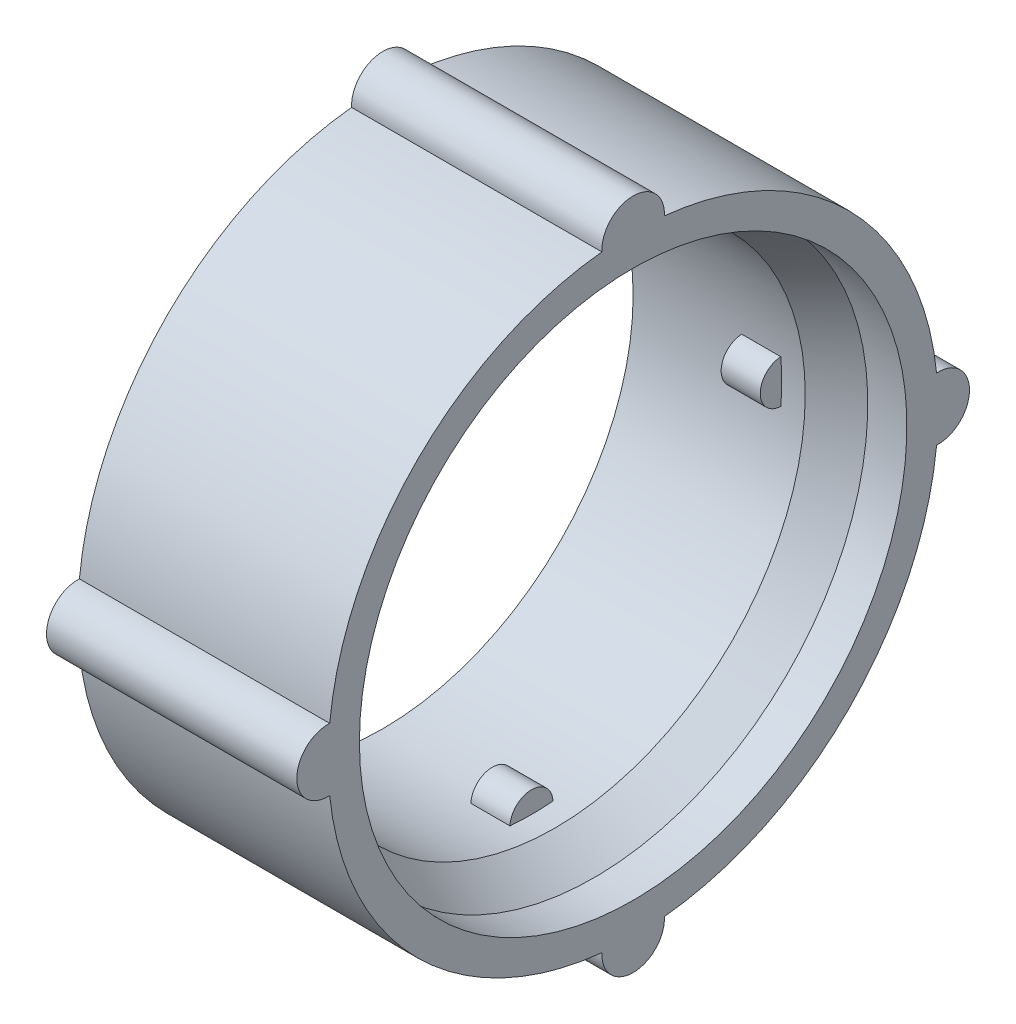
from build123d import *

# Parameters (mm, degrees)
SKETCH1_W           = 16
SKETCH1_H           = 3.5
BOSS_EXTRUDE1_START = -7
SKETCH3_R           = 1.375
BOSS_EXTRUDE1_DEPTH = 2.5
SKETCH4_R           = 2
BOSS_EXTRUDE2_DEPTH = 16


with BuildPart() as part:
    # Sketch1 → Revolve1 (revolve)
    with BuildSketch(Plane(origin=(0, 0, 0), x_dir=(1, 0, 0), z_dir=(0, 1, 0)), mode=Mode.PRIVATE) as revolve1_sk:
        with Locations((8, 17.75)):
            Rectangle(SKETCH1_W, SKETCH1_H)
    revolve(revolve1_sk.sketch.rotate(Axis((0, 0, 0), (1, 0, 0)), 180), axis=Axis((0, 0, 0), (1, 0, 0)))

    # Sketch2 → Cut-Revolve1 (revolve, cut)
    with BuildSketch(Plane(origin=(0, 0, 0), x_dir=(1, 0, 0), z_dir=(0, 1, 0)), mode=Mode.PRIVATE) as cut_revolve1_sk:
        Polygon((16, 17.5), (13.5, 17.5), (11, 16), (16, 16), align=None)
    revolve(cut_revolve1_sk.sketch.rotate(Axis((0, 0, 0), (1, 0, 0)), 180), axis=Axis((0, 0, 0), (1, 0, 0)), mode=Mode.SUBTRACT)

    # Sketch3 → Boss-Extrude1 (add)
    with BuildSketch(Plane.ZY.offset(BOSS_EXTRUDE1_START)):
        with Locations((0, 16)):
            Circle(SKETCH3_R)
        with Locations((16, 0)):
            Circle(SKETCH3_R)
        with Locations((0, -16)):
            Circle(SKETCH3_R)
        with Locations((-16, 0)):
            Circle(SKETCH3_R)
    extrude(amount=-BOSS_EXTRUDE1_DEPTH)

    # Sketch4 → Boss-Extrude2 (add)
    with BuildSketch(Plane.ZY):
        with Locations((0, 19.5)):
            Circle(SKETCH4_R)
        with Locations((19.5, 0)):
            Circle(SKETCH4_R)
        with Locations((0, -19.5)):
            Circle(SKETCH4_R)
        with Locations((-19.5, 0)):
            Circle(SKETCH4_R)
    extrude(amount=-BOSS_EXTRUDE2_DEPTH)


solid = part.part
